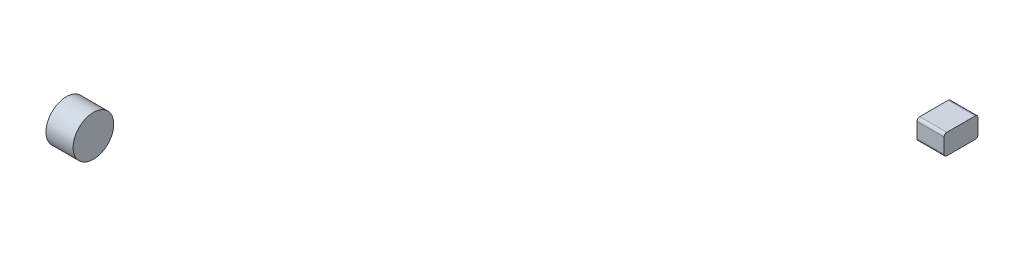
from build123d import *

# Parameters (mm, degrees)
SKETCH1_R      = 1.905
EXTRUDE1_DEPTH = 2.54
EXTRUDE2_DEPTH = 2.54


with BuildPart() as part:
    # Sketch1 → Extrude1 (new body)
    with BuildSketch(Plane(origin=(0, 0, 0), x_dir=(0, 0, -1), z_dir=(1, 0, 0))):
        with Locations((-15.24, -25.4)):
            Circle(SKETCH1_R)
    extrude(amount=-EXTRUDE1_DEPTH)


with BuildPart() as body_2:
    # Sketch2 → Extrude2 (new body)
    with BuildSketch(Plane(origin=(63.5, 0, 0), x_dir=(0, 0, -1), z_dir=(1, 0, 0))):
        with BuildLine():
            Line((-1.3335, 0.9525), (1.3335, 0.9525))
            ThreePointArc((1.3335, 0.9525), (1.513105122, 0.878105122), (1.5875, 0.6985))
            Line((1.5875, 0.6985), (1.5875, -0.6985))
            ThreePointArc((1.5875, -0.6985), (1.513105122, -0.878105122), (1.3335, -0.9525))
            Line((1.3335, -0.9525), (-1.3335, -0.9525))
            ThreePointArc((-1.3335, -0.9525), (-1.513105122, -0.878105122), (-1.5875, -0.6985))
            Line((-1.5875, -0.6985), (-1.5875, 0.6985))
            ThreePointArc((-1.5875, 0.6985), (-1.513105122, 0.878105122), (-1.3335, 0.9525))
        make_face()
    extrude(amount=EXTRUDE2_DEPTH)


solid = Compound([part.part, body_2.part])
